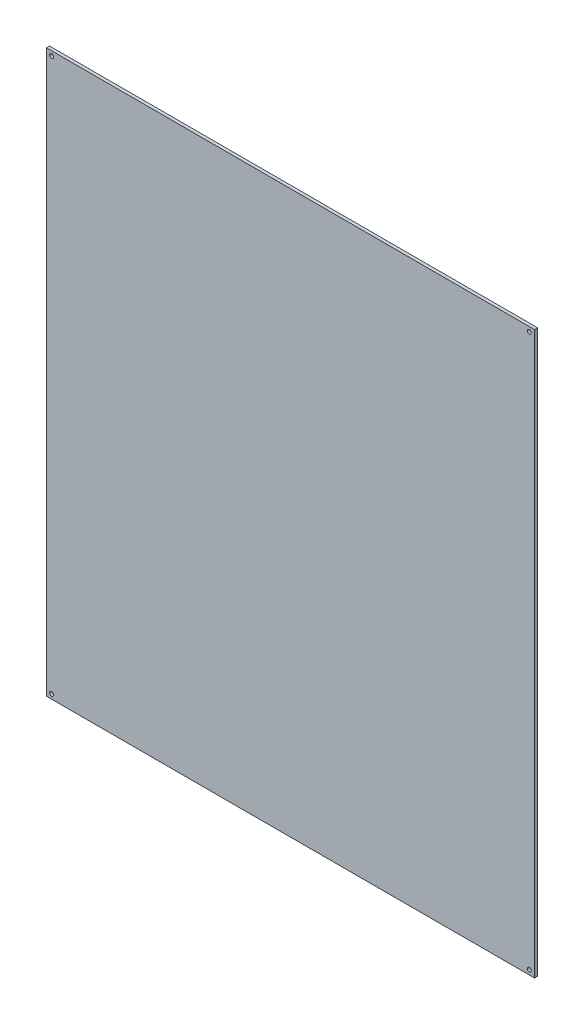
from build123d import *

# Parameters (mm, degrees)
SCHIZZO1_W                   = 796
SCHIZZO1_H                   = 916
SCHIZZO1_R                   = 3.25
ESTRUSIONE_ESTRUSIONE1_DEPTH = 5


with BuildPart() as part:
    # Schizzo1 → Estrusione-Estrusione1 (new body)
    with BuildSketch(Plane.XY.offset(5)):
        with Locations((279.5, 260.5)):
            Rectangle(SCHIZZO1_W, SCHIZZO1_H)
        with Locations(Location((-110, -190, 0), (0, 0, 180))):
            Circle(SCHIZZO1_R, mode=Mode.SUBTRACT)
        with Locations(Location((-110, 711, 0), (0, 0, 180))):
            Circle(SCHIZZO1_R, mode=Mode.SUBTRACT)
        with Locations(Location((669, 711, 0), (0, 0, 180))):
            Circle(SCHIZZO1_R, mode=Mode.SUBTRACT)
        with Locations(Location((669, -190, 0), (0, 0, 180))):
            Circle(SCHIZZO1_R, mode=Mode.SUBTRACT)
    extrude(amount=-ESTRUSIONE_ESTRUSIONE1_DEPTH)


solid = part.part
